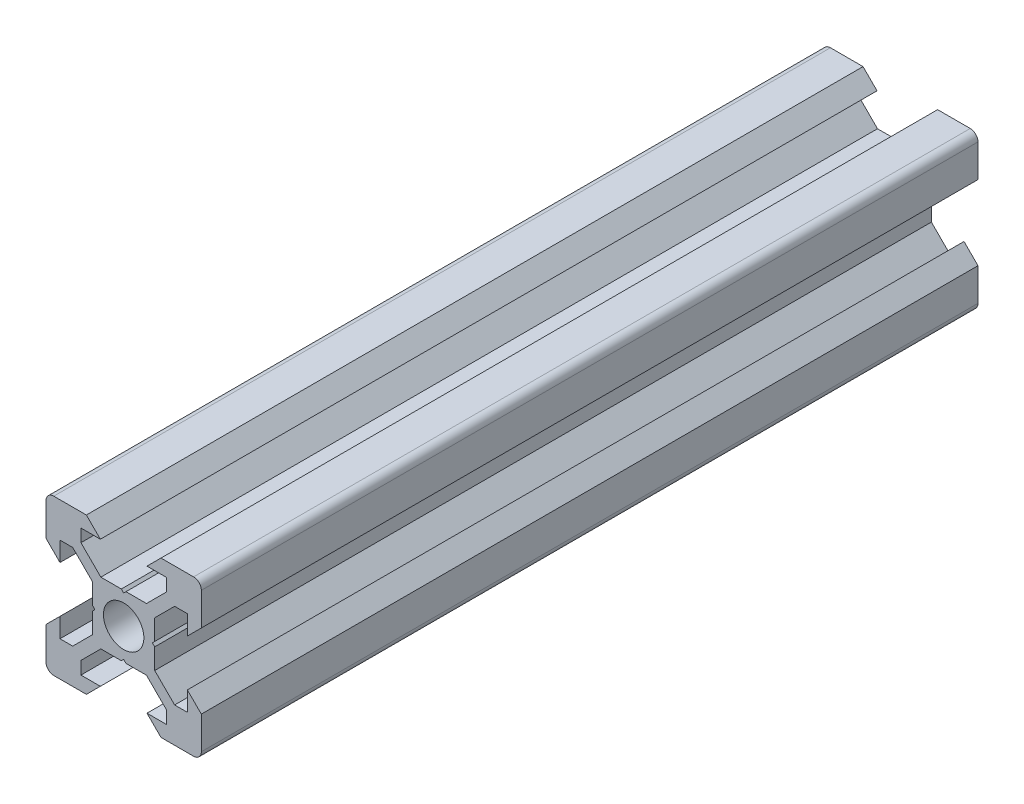
from build123d import *

# Parameters (mm, degrees)
SKETCH1_R           = 2.6
BOSS_EXTRUDE1_DEPTH = 100


with BuildPart() as part:
    # Sketch1 → Boss-Extrude1 (new body)
    with BuildSketch(Plane.XY):
        with BuildLine():
            Line((10.336788111, -8.113366567), (10.336788111, -3.913366567))
            Line((10.336788111, -3.913366567), (8.536788111, -2.113366567))
            Line((8.536788111, -2.113366567), (8.536788111, -4.613366567))
            Line((8.536788111, -4.613366567), (6.897448282, -4.613366567))
            Line((6.897448282, -4.613366567), (4.336788111, -2.052706395))
            Line((4.336788111, -2.052706395), (4.336788111, 0.586633433))
            Line((4.336788111, 0.586633433), (4.036788111, 0.886633433))
            Line((4.036788111, 0.886633433), (4.336788111, 1.186633433))
            Line((4.336788111, 1.186633433), (4.336788111, 3.825973261))
            Line((4.336788111, 3.825973261), (6.897448282, 6.386633433))
            Line((6.897448282, 6.386633433), (8.536788111, 6.386633433))
            Line((8.536788111, 6.386633433), (8.536788111, 3.886633433))
            Line((8.536788111, 3.886633433), (10.336788111, 5.686633433))
            Line((10.336788111, 5.686633433), (10.336788111, 9.886633433))
            ThreePointArc((10.336788111, 9.886633433), (10.043894892, 10.593740214), (9.336788111, 10.886633433))
            Line((9.336788111, 10.886633433), (5.136788111, 10.886633433))
            Line((5.136788111, 10.886633433), (3.336788111, 9.086633433))
            Line((3.336788111, 9.086633433), (5.836788111, 9.086633433))
            Line((5.836788111, 9.086633433), (5.836788111, 7.447293605))
            Line((5.836788111, 7.447293605), (3.276127939, 4.886633433))
            Line((3.276127939, 4.886633433), (0.636788111, 4.886633433))
            Line((0.636788111, 4.886633433), (0.336788111, 4.586633433))
            Line((0.336788111, 4.586633433), (0.036788111, 4.886633433))
            Line((0.036788111, 4.886633433), (-2.602551718, 4.886633433))
            Line((-2.602551718, 4.886633433), (-5.163211889, 7.447293605))
            Line((-5.163211889, 7.447293605), (-5.163211889, 9.086633433))
            Line((-5.163211889, 9.086633433), (-2.663211889, 9.086633433))
            Line((-2.663211889, 9.086633433), (-4.463211889, 10.886633433))
            Line((-4.463211889, 10.886633433), (-8.663211889, 10.886633433))
            ThreePointArc((-8.663211889, 10.886633433), (-9.370318671, 10.593740214), (-9.663211889, 9.886633433))
            Line((-9.663211889, 9.886633433), (-9.663211889, 5.686633433))
            Line((-9.663211889, 5.686633433), (-7.863211889, 3.886633433))
            Line((-7.863211889, 3.886633433), (-7.863211889, 6.386633433))
            Line((-7.863211889, 6.386633433), (-6.223872061, 6.386633433))
            Line((-6.223872061, 6.386633433), (-3.663211889, 3.825973261))
            Line((-3.663211889, 3.825973261), (-3.663211889, 1.186633433))
            Line((-3.663211889, 1.186633433), (-3.363211889, 0.886633433))
            Line((-3.363211889, 0.886633433), (-3.663211889, 0.586633433))
            Line((-3.663211889, 0.586633433), (-3.663211889, -2.052706395))
            Line((-3.663211889, -2.052706395), (-6.223872061, -4.613366567))
            Line((-6.223872061, -4.613366567), (-7.863211889, -4.613366567))
            Line((-7.863211889, -4.613366567), (-7.863211889, -2.113366567))
            Line((-7.863211889, -2.113366567), (-9.663211889, -3.913366567))
            Line((-9.663211889, -3.913366567), (-9.663211889, -8.113366567))
            ThreePointArc((-9.663211889, -8.113366567), (-9.370318671, -8.820473348), (-8.663211889, -9.113366567))
            Line((-8.663211889, -9.113366567), (-4.463211889, -9.113366567))
            Line((-4.463211889, -9.113366567), (-2.663211889, -7.313366567))
            Line((-2.663211889, -7.313366567), (-5.163211889, -7.313366567))
            Line((-5.163211889, -7.313366567), (-5.163211889, -5.674026739))
            Line((-5.163211889, -5.674026739), (-2.602551718, -3.113366567))
            Line((-2.602551718, -3.113366567), (0.036788111, -3.113366567))
            Line((0.036788111, -3.113366567), (0.336788111, -2.813366567))
            Line((0.336788111, -2.813366567), (0.636788111, -3.113366567))
            Line((0.636788111, -3.113366567), (3.276127939, -3.113366567))
            Line((3.276127939, -3.113366567), (5.836788111, -5.674026739))
            Line((5.836788111, -5.674026739), (5.836788111, -7.313366567))
            Line((5.836788111, -7.313366567), (3.336788111, -7.313366567))
            Line((3.336788111, -7.313366567), (5.136788111, -9.113366567))
            Line((5.136788111, -9.113366567), (9.336788111, -9.113366567))
            ThreePointArc((9.336788111, -9.113366567), (10.043894892, -8.820473348), (10.336788111, -8.113366567))
        make_face()
        with Locations((0.336788111, 0.886633433)):
            Circle(SKETCH1_R, mode=Mode.SUBTRACT)
    extrude(amount=BOSS_EXTRUDE1_DEPTH)


solid = part.part
